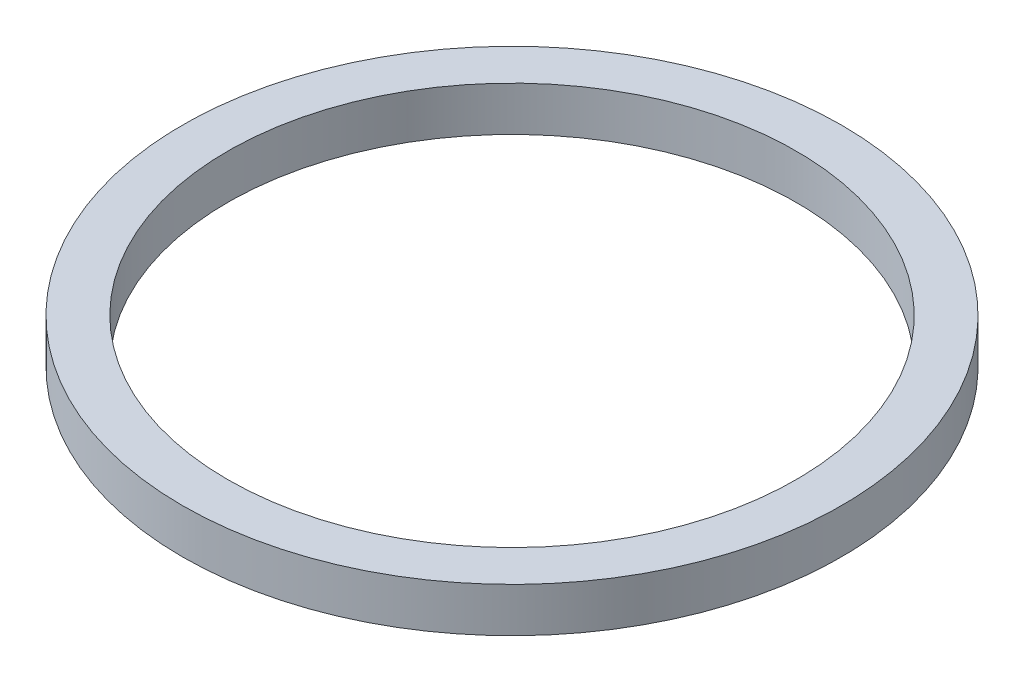
from build123d import *

# Parameters (mm, degrees)
SKETCH2_R           = 185.4
SKETCH2_R_2         = 160
BOSS_EXTRUDE1_DEPTH = 25


with BuildPart() as part:
    # Sketch2 → Boss-Extrude1 (new body)
    with BuildSketch(Plane(origin=(0, 0, 0), x_dir=(1, 0, 0), z_dir=(0, 1, 0))):
        with Locations(Location((0, 0, 0), (0, 0, 270))):
            Circle(SKETCH2_R)
        with Locations(Location((0, 0, 0), (0, 0, 270))):
            Circle(SKETCH2_R_2, mode=Mode.SUBTRACT)
    extrude(amount=BOSS_EXTRUDE1_DEPTH)


solid = part.part
